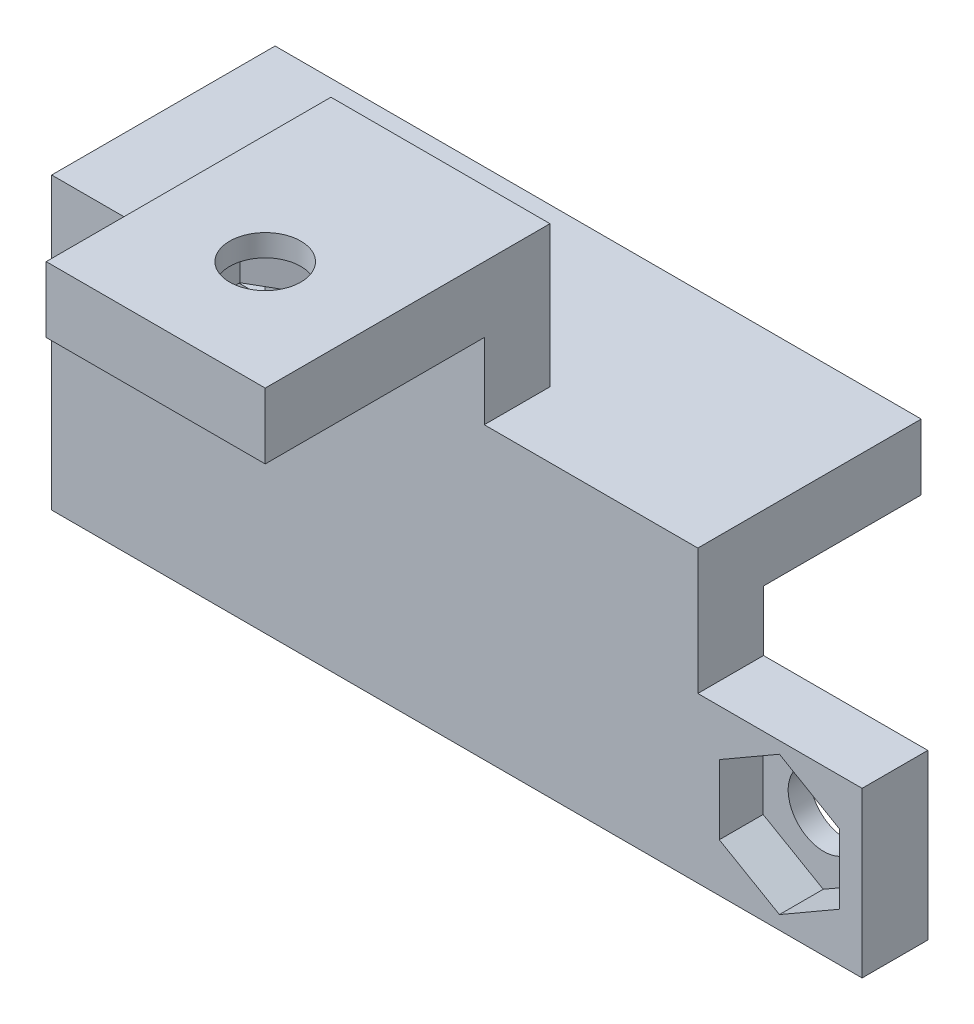
from build123d import *

# Parameters (mm, degrees)
CROQUIS1_R              = 1.625
SALIENTE_EXTRUIR1_DEPTH = 3
CORTAR_EXTRUIR1_DEPTH   = 2
CROQUIS4_W              = 29.5
CROQUIS4_H              = 10.2
SALIENTE_EXTRUIR2_DEPTH = 3
SALIENTE_EXTRUIR3_DEPTH = 3
CROQUIS7_W              = 10
CROQUIS7_H              = 3
SALIENTE_EXTRUIR4_DEPTH = 5
CROQUIS9_W              = 10
CROQUIS9_H              = 3
SALIENTE_EXTRUIR5_DEPTH = 10
CROQUIS10_R             = 1.625
CORTAR_EXTRUIR2_DEPTH   = 3
CORTAR_EXTRUIR3_DEPTH   = 2
CORTAR_EXTRUIR4_START   = -10
CROQUIS12_W             = 3
CROQUIS12_H             = 5
CORTAR_EXTRUIR4_DEPTH   = 10


with BuildPart() as part:
    # Croquis1 → Saliente-Extruir1 (new body)
    with BuildSketch(Plane.XY):
        Polygon((-40.458841365, -24.7), (-77.458841365, -24.7), (-77.458841365, -14.45), (-47.958841365, -14.45), (-47.958841365, -17.2), (-40.458841365, -17.2), align=None)
        with Locations((-44.208841365, -20.95)):
            Circle(CROQUIS1_R, mode=Mode.SUBTRACT)
    extrude(amount=SALIENTE_EXTRUIR1_DEPTH)

    # Croquis2 → Cortar-Extruir1 (cut)
    with BuildSketch(Plane.XY.offset(3)):
        Polygon((-44.232492922, -17.739034302), (-46.977793452, -19.324034302), (-46.977793452, -22.494034302), (-44.232492922, -24.079034302), (-41.487192392, -22.494034302), (-41.487192392, -19.324034302), align=None)
    extrude(amount=-CORTAR_EXTRUIR1_DEPTH, mode=Mode.SUBTRACT)

    # Croquis4 → Saliente-Extruir2 (add)
    with BuildSketch(Plane(origin=(0, -14.45, 0), x_dir=(1, 0, 0), z_dir=(0, 1, 0))):
        with Locations((-62.708841365, 2.1)):
            Rectangle(CROQUIS4_W, CROQUIS4_H)
    extrude(amount=SALIENTE_EXTRUIR2_DEPTH)

    # Croquis6 → Saliente-Extruir3 (add)
    with BuildSketch(Plane.XY.offset(3)):
        Polygon((-62.708841365, -11.45), (-67.708841365, -11.45), (-67.708841365, -5), (-57.708841365, -5), (-57.708841365, -11.45), align=None)
    extrude(amount=-SALIENTE_EXTRUIR3_DEPTH)

    # Croquis7 → Saliente-Extruir4 (add)
    with BuildSketch(Plane(origin=(0, -5, 0), x_dir=(1, 0, 0), z_dir=(0, 1, 0))):
        with Locations((-62.708841365, -1.5)):
            Rectangle(CROQUIS7_W, CROQUIS7_H)
    extrude(amount=SALIENTE_EXTRUIR4_DEPTH)

    # Croquis9 → Saliente-Extruir5 (add)
    with BuildSketch(Plane.XY.offset(3)):
        with Locations((-62.708841365, -6.5)):
            Rectangle(CROQUIS9_W, CROQUIS9_H)
    extrude(amount=SALIENTE_EXTRUIR5_DEPTH)

    # Croquis10 → Cortar-Extruir2 (cut)
    with BuildSketch(Plane.XZ.offset(8)):
        with Locations(Location((-62.708841365, 8, 0), (0, 0, 270))):
            Circle(CROQUIS10_R)
    extrude(amount=-CORTAR_EXTRUIR2_DEPTH, mode=Mode.SUBTRACT)

    # Croquis11 → Cortar-Extruir3 (cut)
    with BuildSketch(Plane.XZ.offset(8)):
        Polygon((-62.708841365, 4.83), (-59.963540835, 6.415), (-59.963540835, 9.585), (-62.708841365, 11.17), (-65.454141895, 9.585), (-65.454141895, 6.415), align=None)
    extrude(amount=-CORTAR_EXTRUIR3_DEPTH, mode=Mode.SUBTRACT)

    # Croquis12 → Cortar-Extruir4 (cut)
    with BuildSketch(Plane(origin=(-57.708841365, 0, 0), x_dir=(0, 0, -1), z_dir=(1, 0, 0)).offset(CORTAR_EXTRUIR4_START)):
        with Locations((-1.5, -2.5)):
            Rectangle(CROQUIS12_W, CROQUIS12_H)
    extrude(amount=CORTAR_EXTRUIR4_DEPTH, mode=Mode.SUBTRACT)


solid = part.part
